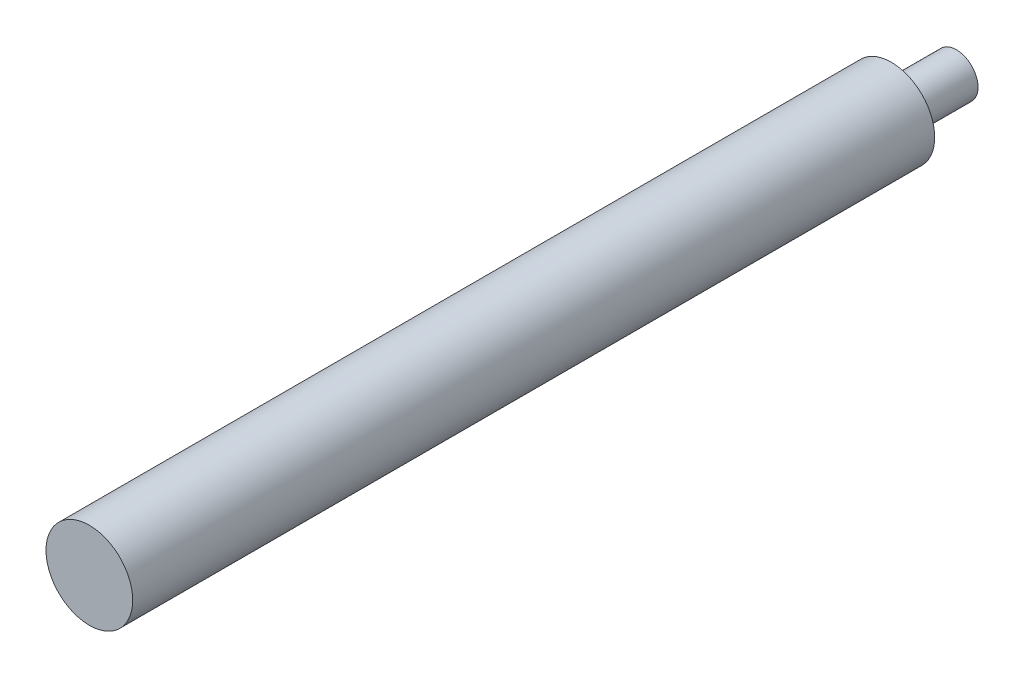
from build123d import *

# Parameters (mm, degrees)
SKETCH_1_R          = 10
EXTRUDE_1_DEPTH     = 200
SKETCH_3_R          = 10.892608919
SKETCH_3_R_2        = 5
CUT_EXTRUDE_1_DEPTH = 15


with BuildPart() as part:
    # 草图1 → 凸台-拉伸1 (new body)
    with BuildSketch(Plane.XY):
        Circle(SKETCH_1_R)
    extrude(amount=EXTRUDE_1_DEPTH)

    # 草图3 → 切除-拉伸1 (cut)
    with BuildSketch(Plane(origin=(0, 0, 0), x_dir=(-1, 0, 0), z_dir=(0, 0, -1))):
        Circle(SKETCH_3_R)
        Circle(SKETCH_3_R_2, mode=Mode.SUBTRACT)
    extrude(amount=-CUT_EXTRUDE_1_DEPTH, mode=Mode.SUBTRACT)


solid = part.part
